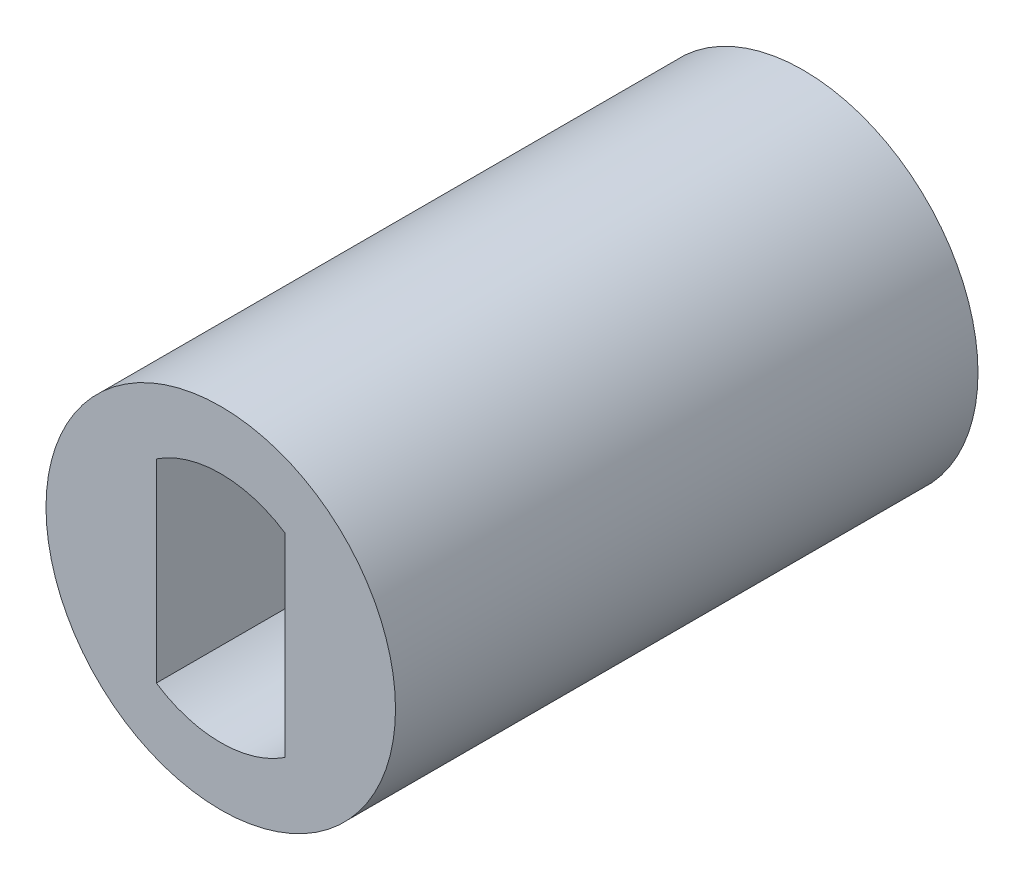
from build123d import *

# Parameters (mm, degrees)
SKETCH1_R           = 9
SKETCH1_R_2         = 6
BOSS_EXTRUDE1_DEPTH = 30


with BuildPart() as part:
    # Sketch1 → Boss-Extrude1 (new body)
    # profile 1 of 3: a face of its own
    with BuildSketch(Plane.XY):
        Circle(SKETCH1_R)
        Circle(SKETCH1_R_2, mode=Mode.SUBTRACT)
    # profile 2 of 3: a face of its own
    with BuildSketch(Plane.XY):
        with BuildLine():
            Line((-3.31662479, -5), (-3.31662479, 5))
            ThreePointArc((-3.31662479, 5), (-6, 0), (-3.31662479, -5))
        make_face()
    # profile 3 of 3: a face of its own
    with BuildSketch(Plane.XY):
        with BuildLine():
            ThreePointArc((6, 0), (5.286764074, 2.837274331), (3.31662479, 5))
            Line((3.31662479, 5), (3.31662479, -5))
            ThreePointArc((3.31662479, -5), (5.286764074, -2.837274331), (6, 0))
        make_face()
    extrude(amount=BOSS_EXTRUDE1_DEPTH)


solid = part.part
